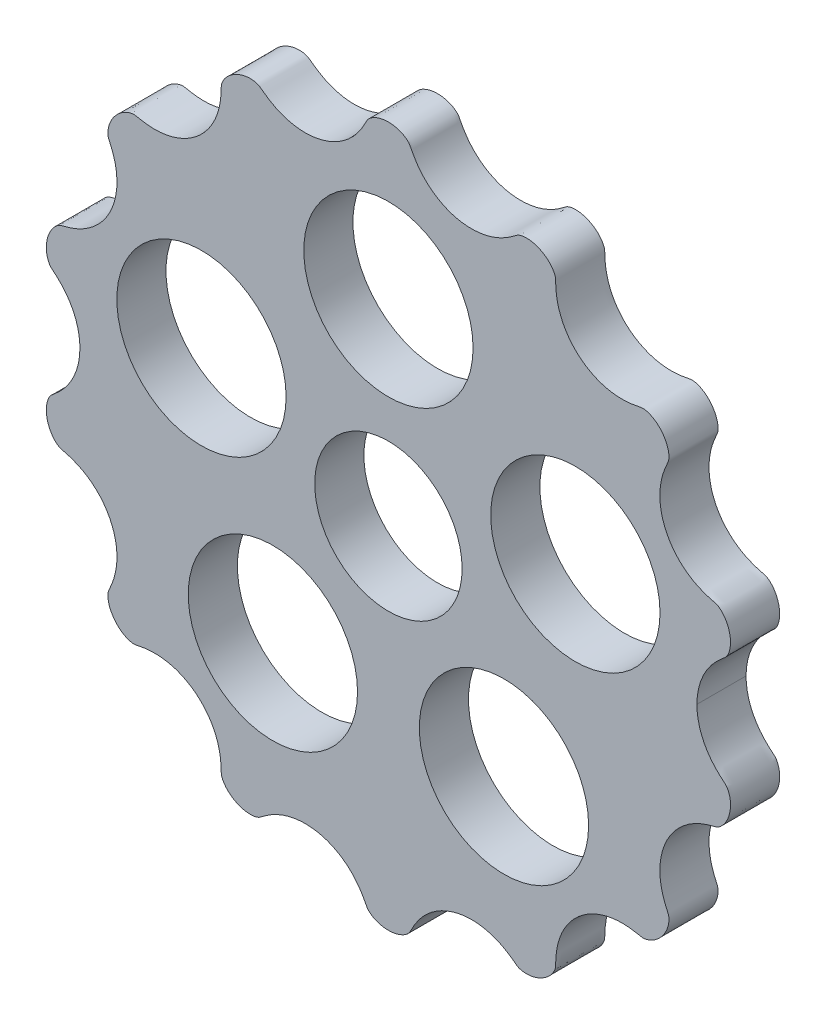
from build123d import *

# Parameters (mm, degrees)
BOSS_EXTRUDE1_DEPTH     = 5
CUT_EXTRUDE1_DEPTH      = 51.047009347
CUT_EXTRUDE1_DEPTH_BACK = 51.047009347
SKETCH2_R               = 7.5
SKETCH2_R_2             = 8.6125


with BuildPart() as part:
    # Sketch1 → Boss-Extrude1 (new body)
    with BuildSketch(Plane.XY):
        with BuildLine():
            add(Edge.make_bspline(
                [(31.387500001, 0), (31.387500026, -0.191409838), (31.401588901, -0.558999959), (31.462455209, -1.100471271), (31.620339294, -1.804284747), (31.845837981, -2.471145024), (32.138779595, -3.108930328), (32.494092862, -3.710123145), (32.854858673, -4.199914121), (33.196385394, -4.592065915), (33.481395935, -4.881104092), (33.695349881, -5.081930357), (33.873225973, -5.238846701), (34.010820914, -5.356420737), (34.126100821, -5.453563577), (34.218425361, -5.531274659), (34.321370212, -5.62224347), (34.422485284, -5.738555324), (34.526616146, -5.906653233), (34.628243438, -6.12445682), (34.743621815, -6.475137863), (34.82251184, -6.967474083), (34.811254504, -7.564402228), (34.66099828, -8.241656973), (34.421812426, -8.783732331), (34.150255287, -9.191239744), (33.902923399, -9.461924187), (33.718729168, -9.62206279), (33.539449442, -9.745646158), (33.366873718, -9.82851183), (33.182347876, -9.874959473), (33.000369503, -9.922220447), (32.781965447, -9.979321761), (32.529245701, -10.0512452), (32.243345998, -10.142503849), (31.926771114, -10.2588661), (31.53767892, -10.4222942), (31.083527431, -10.647638252), (30.574239618, -10.954067456), (30.028205471, -11.361714104), (29.524217315, -11.824126146), (29.068369739, -12.337466637), (28.67067334, -12.890470327), (28.333939546, -13.476344798), (28.059782275, -14.088772828), (27.849481211, -14.72099575), (27.703410573, -15.370288178), (27.622603945, -16.030098641), (27.607228405, -16.69130655), (27.649814288, -17.265897455), (27.725219622, -17.752482883), (27.813085212, -18.152536767), (27.898270543, -18.469924764), (27.997936475, -18.783869539), (28.111163873, -19.094030206), (28.219559407, -19.357776061), (28.316182873, -19.577676184), (28.388632061, -19.73842364), (28.434726782, -19.841332639), (28.476851517, -19.945926516), (28.513980314, -20.063213576), (28.537245623, -20.214070977), (28.54598883, -20.421106537), (28.528667811, -20.664305088), (28.47928151, -20.938475412), (28.390375751, -21.239018767), (28.236129197, -21.613261834), (27.989390261, -22.039715881), (27.629125437, -22.484235416), (27.198981415, -22.848547174), (26.794373433, -23.090233798), (26.465307889, -23.225762423), (26.233368319, -23.292740824), (26.038843002, -23.32569605), (25.885474268, -23.334363645), (25.749412239, -23.320751221), (25.631198197, -23.298729975), (25.503504819, -23.273017085), (25.365815268, -23.245742641), (25.178420466, -23.209936916), (24.861580682, -23.155400634), (24.425008259, -23.09928073), (23.866879414, -23.067374066), (23.227732027, -23.088381833), (22.593283044, -23.168329094), (21.965428014, -23.30847826), (21.350218513, -23.509248362), (20.756629483, -23.768742646), (20.190411759, -24.084901666), (19.647470318, -24.461409291), (19.135282879, -24.898013548), (18.661137886, -25.394205151), (18.233371966, -25.947668209), (17.866637455, -26.540967021), (17.563997377, -27.167132307), (17.327808403, -27.817980776), (17.179598929, -28.402901191), (17.093470407, -28.911646516), (17.050866739, -29.308158909), (17.030864765, -29.590379335), (17.020190427, -29.843097472), (17.014689585, -30.023995072), (17.011815048, -30.163298242), (17.006262468, -30.274671836), (16.997282051, -30.377172787), (16.969252421, -30.510707385), (16.901063234, -30.694922253), (16.791310241, -30.910274358), (16.586800908, -31.216765344), (16.250514589, -31.581105125), (15.776234556, -31.94130894), (15.151789616, -32.243596254), (14.576675723, -32.392171877), (14.085466172, -32.431000594), (13.718944162, -32.403056711), (13.480348058, -32.356853678), (13.294179245, -32.29774802), (13.161187619, -32.23471833), (13.05697471, -32.166085739), (12.974296506, -32.105122346), (12.871971951, -32.027775281), (12.749006547, -31.935279664), (12.577291727, -31.808567221), (12.354010593, -31.651756245), (12.02569938, -31.43786759), (11.581394199, -31.184384729), (11.040417657, -30.930285331), (10.39416822, -30.701278451), (9.72549465, -30.537871575), (8.869598258, -30.419503137), (7.847967202, -30.419724686), (6.847316772, -30.59085254), (5.900714768, -30.922312211), (5.171539807, -31.290180531), (4.619855446, -31.639804277), (4.106739884, -32.03943957), (3.636092555, -32.484307904), (3.263184578, -32.909891173), (2.973001992, -33.296991115), (2.75046914, -33.633117775), (2.604559005, -33.874823303), (2.486102169, -34.085791865), (2.394242469, -34.257795953), (2.32582382, -34.389053594), (2.261066815, -34.514691373), (2.199326518, -34.634590338), (2.123715494, -34.761953075), (2.018885882, -34.88485403), (1.870287205, -35.020455893), (1.674923028, -35.161740123), (1.434956792, -35.297359485), (1.150119786, -35.419334252), (0.769460426, -35.537430054), (0.286766328, -35.619545906), (-0.204612623, -35.625338906), (-0.690683081, -35.554699391), (-1.077585802, -35.444910309), (-1.368129168, -35.329321221), (-1.61386946, -35.198992075), (-1.81608862, -35.062763611), (-1.970779169, -34.931010668), (-2.084032597, -34.813065554), (-2.159333384, -34.703851255), (-2.209053216, -34.614659636), (-2.256431362, -34.524252224), (-2.305956588, -34.427505575), (-2.366847582, -34.309990563), (-2.458788176, -34.135985113), (-2.57698427, -33.922308772), (-2.722647971, -33.677407664), (-2.945018932, -33.336509051), (-3.235549832, -32.943659771), (-3.609341694, -32.51191421), (-4.081749946, -32.060730701), (-4.597449463, -31.655389456), (-5.152453795, -31.300775586), (-5.887288142, -30.927417212), (-6.839439956, -30.592308516), (-7.844773834, -30.419725534), (-8.869598343, -30.419502994), (-9.725494855, -30.537871577), (-10.394168351, -30.701278359), (-11.040417843, -30.930285299), (-11.581394349, -31.184384651), (-12.025699555, -31.437867537), (-12.354010755, -31.651756173), (-12.577291898, -31.808567158), (-12.749006714, -31.935279595), (-12.87197212, -32.027775213), (-12.974296676, -32.105122278), (-13.056974879, -32.16608567), (-13.161187789, -32.23471826), (-13.294179415, -32.29774795), (-13.480348228, -32.356853607), (-13.718944333, -32.403056639), (-14.085466343, -32.43100052), (-14.576675893, -32.3921718), (-15.151789786, -32.243596174), (-15.776234724, -31.941308856), (-16.250514756, -31.581105039), (-16.586801072, -31.216765257), (-16.791310404, -30.91027427), (-16.901063396, -30.694922164), (-16.969252582, -30.510707296), (-16.997282211, -30.377172697), (-17.006262628, -30.274671746), (-17.011815207, -30.163298152), (-17.014689744, -30.023994982), (-17.020190584, -29.843097383), (-17.030864921, -29.590379245), (-17.050866894, -29.30815882), (-17.09347056, -28.911646425), (-17.179599078, -28.402901103), (-17.32780855, -27.817980681), (-17.56399752, -27.167132219), (-17.866637595, -26.540966919), (-18.233372102, -25.947668125), (-18.661138021, -25.394205032), (-19.135283008, -24.898013482), (-19.647470451, -24.461409131), (-20.19041188, -24.084901652), (-20.756629618, -23.76874238), (-21.35021862, -23.50924851), (-21.965428164, -23.308477706), (-22.593283118, -23.168329727), (-23.227732235, -23.08838034), (-23.866879768, -23.067372219), (-24.425008282, -23.099281338), (-24.861580723, -23.155401789), (-25.178420614, -23.20993637), (-25.365815382, -23.245742639), (-25.503504943, -23.273016934), (-25.63119832, -23.298729836), (-25.749412362, -23.320751087), (-25.885474391, -23.334363509), (-26.038843125, -23.325695912), (-26.233368442, -23.292740686), (-26.465308011, -23.225762284), (-26.794373555, -23.090233657), (-27.198981535, -22.848547031), (-27.629125556, -22.48423527), (-27.989390377, -22.039715734), (-28.236129311, -21.613261685), (-28.390375863, -21.239018618), (-28.47928162, -20.938475262), (-28.52866792, -20.664304937), (-28.545988937, -20.421106387), (-28.53724573, -20.214070826), (-28.513980419, -20.063213426), (-28.476851622, -19.945926366), (-28.434726887, -19.841332489), (-28.388632165, -19.738423491), (-28.316182976, -19.577676035), (-28.219559509, -19.357775912), (-28.111163974, -19.094030058), (-27.997936574, -18.783869392), (-27.898270641, -18.469924617), (-27.813085308, -18.152536621), (-27.725219716, -17.752482737), (-27.649814379, -17.265897309), (-27.607228493, -16.691306405), (-27.622604029, -16.030098496), (-27.703410654, -15.370288032), (-27.849481289, -14.720995603), (-28.059782349, -14.08877268), (-28.333939617, -13.476344649), (-28.670673408, -12.890470176), (-29.068369804, -12.337466484), (-29.524217378, -11.824125991), (-30.028205531, -11.361713946), (-30.574239676, -10.954067295), (-31.083527487, -10.647638088), (-31.537678975, -10.422294034), (-31.926771168, -10.258865932), (-32.243346052, -10.142503679), (-32.529245754, -10.051245028), (-32.7819655, -9.979321588), (-33.000369556, -9.922220273), (-33.182347928, -9.874959298), (-33.366873769, -9.828511654), (-33.539449494, -9.745645982), (-33.718729219, -9.622062612), (-33.902923449, -9.461924008), (-34.150255335, -9.191239564), (-34.421812473, -8.78373215), (-34.660998323, -8.241656791), (-34.811254544, -7.564402044), (-34.822511877, -6.967473899), (-34.743621849, -6.47513768), (-34.62824347, -6.124456638), (-34.526616177, -5.906653051), (-34.422485315, -5.738555143), (-34.321370242, -5.622243289), (-34.21842539, -5.531274479), (-34.12610085, -5.453563397), (-34.010820943, -5.356420557), (-33.873226, -5.238846522), (-33.695349907, -5.081930179), (-33.481395961, -4.881103916), (-33.196385418, -4.592065741), (-32.854858695, -4.199913948), (-32.494092881, -3.710122973), (-32.138779611, -3.108930159), (-31.845837994, -2.471144856), (-31.55891171, -1.622626667), (-31.427525078, -0.911371167), (-31.38750006, -0.367589815), (-31.387500001, 0)],
                knots=[0.103459311, 0.103459311, 0.103459311, 0.103459311, 0.103459311, 0.108282381, 0.112721697, 0.117161213, 0.121600728, 0.125987713, 0.130374698, 0.13472717, 0.136903406, 0.139079642, 0.14059969, 0.142119739, 0.142879763, 0.143639788, 0.144399812, 0.145159837, 0.146335778, 0.147511719, 0.149360116, 0.151208513, 0.155610339, 0.160013805, 0.164294975, 0.168579928, 0.170438328, 0.172296728, 0.173508946, 0.174721165, 0.175908015, 0.177094865, 0.178281716, 0.179468566, 0.181592661, 0.183716756, 0.185840851, 0.187964946, 0.192222657, 0.196480367, 0.200793288, 0.20510621, 0.209427538, 0.213748866, 0.217926621, 0.222104375, 0.22630704, 0.230509705, 0.23466829, 0.238826875, 0.242945784, 0.245005239, 0.247064694, 0.249143974, 0.251223255, 0.253302535, 0.255381816, 0.256328153, 0.25727449, 0.257747659, 0.258220828, 0.259167165, 0.260371245, 0.261575325, 0.263435854, 0.265296383, 0.267377025, 0.269457666, 0.273617251, 0.277665028, 0.281712441, 0.283576659, 0.285440877, 0.286611911, 0.287782945, 0.288539492, 0.289296038, 0.290052585, 0.290809131, 0.291821706, 0.29283428, 0.294859428, 0.298909724, 0.302906114, 0.306902505, 0.310950904, 0.314999303, 0.319091512, 0.323183722, 0.327249058, 0.331314394, 0.335713939, 0.340113485, 0.344510805, 0.348908126, 0.353257429, 0.357606733, 0.361927473, 0.364087843, 0.366248213, 0.367652094, 0.369055974, 0.370459854, 0.370810824, 0.371161794, 0.371863734, 0.373051087, 0.37423844, 0.376092101, 0.377945762, 0.382308889, 0.386671268, 0.390992848, 0.395317569, 0.397172902, 0.399028234, 0.400230037, 0.40143184, 0.402078268, 0.402724696, 0.403371125, 0.404017553, 0.405310409, 0.406603265, 0.408747638, 0.41089201, 0.415180756, 0.419482319, 0.423783882, 0.428139722, 0.432495561, 0.44121588, 0.449419283, 0.453546476, 0.457673669, 0.461762281, 0.465850894, 0.469909329, 0.473967765, 0.475999805, 0.478031845, 0.480063885, 0.481079905, 0.482095925, 0.482944924, 0.483793923, 0.484642922, 0.48549192, 0.486669259, 0.487846597, 0.489700948, 0.491555299, 0.493597948, 0.495640598, 0.499725294, 0.503848229, 0.505910078, 0.507971927, 0.50984196, 0.511711993, 0.512906303, 0.514100613, 0.514957378, 0.515814142, 0.516242525, 0.516670907, 0.517527672, 0.518553103, 0.519578534, 0.521629396, 0.523680258, 0.52573112, 0.529831328, 0.533931536, 0.538048962, 0.542166388, 0.546333484, 0.55050058, 0.55878412, 0.567504439, 0.571860278, 0.576216118, 0.580517681, 0.584819244, 0.58910799, 0.591252362, 0.593396735, 0.594689591, 0.595982447, 0.596628875, 0.597275304, 0.597921732, 0.59856816, 0.599769963, 0.600971766, 0.602827098, 0.604682431, 0.609007152, 0.613328732, 0.617691111, 0.622054238, 0.623907899, 0.62576156, 0.626948913, 0.628136266, 0.628838206, 0.629189176, 0.629540146, 0.630944026, 0.632347906, 0.633751787, 0.635912157, 0.638072527, 0.642393267, 0.646742571, 0.651091874, 0.655489195, 0.659886515, 0.664286061, 0.668685606, 0.672750942, 0.676816278, 0.680908488, 0.685000697, 0.689049096, 0.693097495, 0.697093886, 0.701090276, 0.705140572, 0.70716572, 0.708178294, 0.709190869, 0.709947415, 0.710703962, 0.711460508, 0.712217055, 0.713388089, 0.714559123, 0.716423341, 0.718287559, 0.722334972, 0.726382749, 0.730542334, 0.732622975, 0.734703617, 0.736564146, 0.738424675, 0.739628755, 0.740832835, 0.741779172, 0.742252341, 0.74272551, 0.743671847, 0.744618184, 0.746697465, 0.748776745, 0.750856026, 0.752935306, 0.754994761, 0.757054216, 0.761173125, 0.76533171, 0.769490295, 0.77369296, 0.777895625, 0.782073379, 0.786251134, 0.790572462, 0.79489379, 0.799206712, 0.803519633, 0.807777343, 0.812035054, 0.814159149, 0.816283244, 0.818407339, 0.820531434, 0.821718284, 0.822905135, 0.824091985, 0.825278835, 0.826491054, 0.827703272, 0.829561672, 0.831420072, 0.835705025, 0.839986195, 0.844389661, 0.848791487, 0.850639884, 0.852488281, 0.853664222, 0.854840163, 0.855600188, 0.856360212, 0.857120237, 0.857880261, 0.85940031, 0.860920358, 0.863096594, 0.86527283, 0.869625302, 0.874012287, 0.878399272, 0.882838787, 0.887278303, 0.896540688, 0.896540688, 0.896540688, 0.896540688, 0.896540688], degree=4))
            add(Edge.make_bspline(
                [(31.387500001, 0), (31.387500027, 0.191409839), (31.401588902, 0.55899996), (31.462455211, 1.100471272), (31.620339298, 1.804284749), (31.845837987, 2.471145025), (32.138779603, 3.108930328), (32.494092872, 3.710123144), (32.854858684, 4.19991412), (33.196385406, 4.592065913), (33.481395948, 4.881104089), (33.695349894, 5.081930353), (33.873225987, 5.238846696), (34.010820929, 5.356420732), (34.126100836, 5.453563572), (34.218425375, 5.531274654), (34.321370227, 5.622243465), (34.4224853, 5.738555318), (34.526616162, 5.906653227), (34.628243454, 6.124456814), (34.743621832, 6.475137856), (34.822511859, 6.967474076), (34.811254524, 7.564402221), (34.660998301, 8.241656967), (34.421812449, 8.783732325), (34.150255311, 9.191239739), (33.902923424, 9.461924182), (33.718729194, 9.622062786), (33.539449468, 9.745646155), (33.366873744, 9.828511827), (33.182347902, 9.87495947), (33.000369529, 9.922220445), (32.781965474, 9.97932176), (32.529245727, 10.051245199), (32.243346025, 10.142503849), (31.926771141, 10.258866101), (31.537678948, 10.422294202), (31.083527459, 10.647638255), (30.574239647, 10.954067461), (30.028205501, 11.36171411), (29.524217346, 11.824126153), (29.068369772, 12.337466645), (28.670673374, 12.890470336), (28.333939582, 13.476344808), (28.059782312, 14.088772839), (27.84948125, 14.720995761), (27.703410613, 15.37028819), (27.622603987, 16.030098654), (27.607228449, 16.691306562), (27.649814333, 17.265897467), (27.725219669, 17.752482895), (27.81308526, 18.152536779), (27.898270592, 18.469924776), (27.997936524, 18.78386955), (28.111163924, 19.094030217), (28.219559458, 19.357776071), (28.316182925, 19.577676195), (28.388632113, 19.73842365), (28.434726835, 19.841332649), (28.47685157, 19.945926526), (28.513980367, 20.063213586), (28.537245677, 20.214070986), (28.545988883, 20.421106547), (28.528667865, 20.664305097), (28.479281565, 20.938475422), (28.390375807, 21.239018777), (28.236129254, 21.613261844), (27.989390319, 22.039715892), (27.629125497, 22.484235428), (27.198981475, 22.848547187), (26.794373494, 23.090233813), (26.46530795, 23.225762438), (26.233368381, 23.292740839), (26.038843063, 23.325696066), (25.88547433, 23.334363661), (25.749412301, 23.320751238), (25.631198258, 23.298729992), (25.50350488, 23.273017103), (25.365815329, 23.245742659), (25.178420527, 23.209936935), (24.861580743, 23.155400654), (24.42500832, 23.09928075), (23.866879475, 23.067374088), (23.227732087, 23.088381856), (22.593283105, 23.16832912), (21.965428075, 23.308478287), (21.350218575, 23.509248391), (20.756629546, 23.768742677), (20.190411822, 24.084901697), (19.647470383, 24.461409324), (19.135282945, 24.898013583), (18.661137953, 25.394205187), (18.233372034, 25.947668245), (17.866637525, 26.540967059), (17.563997449, 27.167132345), (17.327808476, 27.817980815), (17.179599003, 28.402901231), (17.093470484, 28.911646556), (17.050866817, 29.308158949), (17.030864843, 29.590379375), (17.020190505, 29.843097512), (17.014689665, 30.023995112), (17.011815128, 30.163298282), (17.006262548, 30.274671876), (16.997282131, 30.377172827), (16.969252501, 30.510707425), (16.901063315, 30.694922293), (16.791310323, 30.910274399), (16.58680099, 31.216765385), (16.250514673, 31.581105167), (15.77623464, 31.941308983), (15.151789701, 32.243596299), (14.576675808, 32.392171923), (14.085466258, 32.431000642), (13.718944248, 32.40305676), (13.480348143, 32.356853728), (13.29417933, 32.29774807), (13.161187704, 32.23471838), (13.056974794, 32.166085789), (12.974296591, 32.105122397), (12.871972035, 32.027775332), (12.749006631, 31.935279715), (12.577291811, 31.808567273), (12.354010677, 31.651756297), (12.025699463, 31.437867643), (11.581394281, 31.184384784), (11.040417739, 30.930285386), (10.394168301, 30.701278509), (9.72549473, 30.537871634), (8.869598338, 30.419503198), (7.847967282, 30.41972475), (6.847316852, 30.590852607), (5.90071485, 30.922312281), (5.17153989, 31.290180602), (4.619855529, 31.63980435), (4.106739969, 32.039439644), (3.63609264, 32.484307979), (3.263184664, 32.90989125), (2.97300208, 33.296991192), (2.750469229, 33.633117853), (2.604559095, 33.874823381), (2.486102259, 34.085791943), (2.394242559, 34.257796032), (2.325823911, 34.389053673), (2.261066906, 34.514691452), (2.199326609, 34.634590417), (2.123715586, 34.761953154), (2.018885974, 34.884854109), (1.870287297, 35.020455973), (1.674923121, 35.161740204), (1.434956885, 35.297359566), (1.150119879, 35.419334334), (0.76946052, 35.537430137), (0.286766422, 35.61954599), (-0.204612529, 35.625338991), (-0.690682987, 35.554699478), (-1.077585708, 35.444910397), (-1.368129075, 35.329321309), (-1.613869367, 35.198992165), (-1.816088528, 35.062763701), (-1.970779077, 34.931010759), (-2.084032505, 34.813065645), (-2.159333292, 34.703851346), (-2.209053124, 34.614659727), (-2.256431271, 34.524252315), (-2.305956498, 34.427505666), (-2.366847491, 34.309990654), (-2.458788086, 34.135985204), (-2.576984181, 33.922308864), (-2.722647882, 33.677407756), (-2.945018844, 33.336509144), (-3.235549745, 32.943659864), (-3.609341608, 32.511914305), (-4.081749861, 32.060730797), (-4.59744938, 31.655389553), (-5.152453712, 31.300775684), (-5.88728806, 30.927417313), (-6.839439876, 30.592308619), (-7.844773754, 30.41972564), (-8.869598262, 30.419503102), (-9.725494775, 30.537871688), (-10.39416827, 30.701278471), (-11.040417762, 30.930285413), (-11.581394266, 31.184384766), (-12.025699472, 31.437867654), (-12.354010671, 31.651756291), (-12.577291814, 31.808567276), (-12.74900663, 31.935279713), (-12.871972035, 32.027775332), (-12.974296591, 32.105122397), (-13.056974794, 32.166085789), (-13.161187704, 32.23471838), (-13.29417933, 32.29774807), (-13.480348143, 32.356853728), (-13.718944248, 32.40305676), (-14.085466257, 32.431000642), (-14.576675808, 32.392171923), (-15.151789701, 32.243596299), (-15.77623464, 31.941308983), (-16.250514673, 31.581105167), (-16.58680099, 31.216765385), (-16.791310323, 30.910274399), (-16.901063315, 30.694922293), (-16.969252501, 30.510707425), (-16.997282131, 30.377172827), (-17.006262548, 30.274671876), (-17.011815128, 30.163298282), (-17.014689665, 30.023995112), (-17.020190505, 29.843097512), (-17.030864843, 29.590379374), (-17.050866817, 29.30815895), (-17.093470484, 28.911646554), (-17.179599003, 28.402901233), (-17.327808477, 27.817980811), (-17.563997448, 27.167132351), (-17.866637525, 26.540967051), (-18.233372033, 25.947668258), (-18.661137954, 25.394205166), (-19.135282942, 24.898013617), (-19.647470386, 24.461409268), (-20.190411816, 24.08490179), (-20.756629556, 23.768742519), (-21.350218558, 23.509248651), (-21.965428103, 23.308477849), (-22.593283057, 23.168329871), (-23.227732174, 23.088380486), (-23.866879707, 23.067372367), (-24.425008221, 23.099281487), (-24.861580662, 23.15540194), (-25.178420553, 23.209936521), (-25.365815321, 23.245742791), (-25.503504881, 23.273017086), (-25.631198259, 23.298729988), (-25.749412301, 23.320751239), (-25.88547433, 23.334363662), (-26.038843063, 23.325696066), (-26.233368381, 23.29274084), (-26.46530795, 23.225762438), (-26.794373494, 23.090233813), (-27.198981475, 22.848547187), (-27.629125497, 22.484235428), (-27.989390319, 22.039715892), (-28.236129254, 21.613261844), (-28.390375807, 21.239018777), (-28.479281565, 20.938475422), (-28.528667865, 20.664305097), (-28.545988883, 20.421106547), (-28.537245677, 20.214070986), (-28.513980367, 20.063213586), (-28.47685157, 19.945926526), (-28.434726834, 19.841332649), (-28.388632113, 19.73842365), (-28.316182925, 19.577676195), (-28.219559458, 19.357776071), (-28.111163924, 19.094030217), (-27.997936524, 18.783869551), (-27.898270592, 18.469924776), (-27.81308526, 18.152536779), (-27.725219669, 17.752482895), (-27.649814333, 17.265897467), (-27.607228449, 16.691306562), (-27.622603987, 16.030098654), (-27.703410613, 15.37028819), (-27.84948125, 14.720995761), (-28.059782312, 14.088772839), (-28.333939582, 13.476344808), (-28.670673374, 12.890470336), (-29.068369772, 12.337466645), (-29.524217346, 11.824126153), (-30.028205501, 11.36171411), (-30.574239647, 10.954067461), (-31.083527459, 10.647638255), (-31.537678948, 10.422294202), (-31.926771141, 10.258866101), (-32.243346025, 10.142503849), (-32.529245727, 10.051245199), (-32.781965474, 9.97932176), (-33.000369529, 9.922220445), (-33.182347902, 9.87495947), (-33.366873744, 9.828511827), (-33.539449468, 9.745646155), (-33.718729194, 9.622062786), (-33.902923424, 9.461924182), (-34.150255311, 9.191239739), (-34.421812449, 8.783732325), (-34.660998301, 8.241656967), (-34.811254524, 7.564402221), (-34.822511859, 6.967474076), (-34.743621832, 6.475137856), (-34.628243454, 6.124456814), (-34.526616162, 5.906653227), (-34.4224853, 5.738555319), (-34.321370227, 5.622243465), (-34.218425375, 5.531274654), (-34.126100835, 5.453563572), (-34.010820929, 5.356420732), (-33.873225987, 5.238846697), (-33.695349894, 5.081930353), (-33.481395948, 4.881104089), (-33.196385406, 4.592065913), (-32.854858684, 4.19991412), (-32.494092872, 3.710123144), (-32.138779603, 3.108930329), (-31.845837987, 2.471145025), (-31.558911692, 1.622626795), (-31.427525061, 0.911371252), (-31.38750005, 0.367589857), (-31.387500001, 0)],
                knots=[0.103459311, 0.103459311, 0.103459311, 0.103459311, 0.103459311, 0.108282381, 0.112721697, 0.117161213, 0.121600728, 0.125987713, 0.130374698, 0.13472717, 0.136903406, 0.139079642, 0.14059969, 0.142119739, 0.142879763, 0.143639788, 0.144399812, 0.145159837, 0.146335778, 0.147511719, 0.149360116, 0.151208513, 0.155610339, 0.160013805, 0.164294975, 0.168579928, 0.170438328, 0.172296728, 0.173508946, 0.174721165, 0.175908015, 0.177094865, 0.178281716, 0.179468566, 0.181592661, 0.183716756, 0.185840851, 0.187964946, 0.192222657, 0.196480367, 0.200793288, 0.20510621, 0.209427538, 0.213748866, 0.217926621, 0.222104375, 0.22630704, 0.230509705, 0.23466829, 0.238826875, 0.242945784, 0.245005239, 0.247064694, 0.249143974, 0.251223255, 0.253302535, 0.255381816, 0.256328153, 0.25727449, 0.257747659, 0.258220828, 0.259167165, 0.260371245, 0.261575325, 0.263435854, 0.265296383, 0.267377025, 0.269457666, 0.273617251, 0.277665028, 0.281712441, 0.283576659, 0.285440877, 0.286611911, 0.287782945, 0.288539492, 0.289296038, 0.290052585, 0.290809131, 0.291821706, 0.29283428, 0.294859428, 0.298909724, 0.302906114, 0.306902505, 0.310950904, 0.314999303, 0.319091512, 0.323183722, 0.327249058, 0.331314394, 0.335713939, 0.340113485, 0.344510805, 0.348908126, 0.353257429, 0.357606733, 0.361927473, 0.364087843, 0.366248213, 0.367652094, 0.369055974, 0.370459854, 0.370810824, 0.371161794, 0.371863734, 0.373051087, 0.37423844, 0.376092101, 0.377945762, 0.382308889, 0.386671268, 0.390992848, 0.395317569, 0.397172902, 0.399028234, 0.400230037, 0.40143184, 0.402078268, 0.402724696, 0.403371125, 0.404017553, 0.405310409, 0.406603265, 0.408747638, 0.41089201, 0.415180756, 0.419482319, 0.423783882, 0.428139722, 0.432495561, 0.44121588, 0.449419283, 0.453546476, 0.457673669, 0.461762281, 0.465850894, 0.469909329, 0.473967765, 0.475999805, 0.478031845, 0.480063885, 0.481079905, 0.482095925, 0.482944924, 0.483793923, 0.484642922, 0.48549192, 0.486669259, 0.487846597, 0.489700948, 0.491555299, 0.493597948, 0.495640598, 0.499725294, 0.503848229, 0.505910078, 0.507971927, 0.50984196, 0.511711993, 0.512906303, 0.514100613, 0.514957378, 0.515814142, 0.516242525, 0.516670907, 0.517527672, 0.518553103, 0.519578534, 0.521629396, 0.523680258, 0.52573112, 0.529831328, 0.533931536, 0.538048962, 0.542166388, 0.546333484, 0.55050058, 0.55878412, 0.567504439, 0.571860278, 0.576216118, 0.580517681, 0.584819244, 0.58910799, 0.591252362, 0.593396735, 0.594689591, 0.595982447, 0.596628875, 0.597275304, 0.597921732, 0.59856816, 0.599769963, 0.600971766, 0.602827098, 0.604682431, 0.609007152, 0.613328732, 0.617691111, 0.622054238, 0.623907899, 0.62576156, 0.626948913, 0.628136266, 0.628838206, 0.629189176, 0.629540146, 0.630944026, 0.632347906, 0.633751787, 0.635912157, 0.638072527, 0.642393267, 0.646742571, 0.651091874, 0.655489195, 0.659886515, 0.664286061, 0.668685606, 0.672750942, 0.676816278, 0.680908488, 0.685000697, 0.689049096, 0.693097495, 0.697093886, 0.701090276, 0.705140572, 0.70716572, 0.708178294, 0.709190869, 0.709947415, 0.710703962, 0.711460508, 0.712217055, 0.713388089, 0.714559123, 0.716423341, 0.718287559, 0.722334972, 0.726382749, 0.730542334, 0.732622975, 0.734703617, 0.736564146, 0.738424675, 0.739628755, 0.740832835, 0.741779172, 0.742252341, 0.74272551, 0.743671847, 0.744618184, 0.746697465, 0.748776745, 0.750856026, 0.752935306, 0.754994761, 0.757054216, 0.761173125, 0.76533171, 0.769490295, 0.77369296, 0.777895625, 0.782073379, 0.786251134, 0.790572462, 0.79489379, 0.799206712, 0.803519633, 0.807777343, 0.812035054, 0.814159149, 0.816283244, 0.818407339, 0.820531434, 0.821718284, 0.822905135, 0.824091985, 0.825278835, 0.826491054, 0.827703272, 0.829561672, 0.831420072, 0.835705025, 0.839986195, 0.844389661, 0.848791487, 0.850639884, 0.852488281, 0.853664222, 0.854840163, 0.855600188, 0.856360212, 0.857120237, 0.857880261, 0.85940031, 0.860920358, 0.863096594, 0.86527283, 0.869625302, 0.874012287, 0.878399272, 0.882838787, 0.887278303, 0.896540689, 0.896540689, 0.896540689, 0.896540689, 0.896540689], degree=4))
        make_face()
    extrude(amount=BOSS_EXTRUDE1_DEPTH)

    # Sketch2 → Cut-Extrude1 (cut, two sides: drawn at the far end of the back side and taken through both)
    with BuildSketch(Plane.XY.offset(5).offset(-CUT_EXTRUDE1_DEPTH_BACK)):
        Circle(SKETCH2_R)
        with Locations((0, 20)):
            Circle(SKETCH2_R_2)
        with Locations((19.021130326, 6.180339887)):
            Circle(SKETCH2_R_2)
        with Locations((11.755705046, -16.180339887)):
            Circle(SKETCH2_R_2)
        with Locations((-11.755705046, -16.180339887)):
            Circle(SKETCH2_R_2)
        with Locations((-19.021130326, 6.180339887)):
            Circle(SKETCH2_R_2)
    extrude(amount=CUT_EXTRUDE1_DEPTH + CUT_EXTRUDE1_DEPTH_BACK, mode=Mode.SUBTRACT)


solid = part.part
